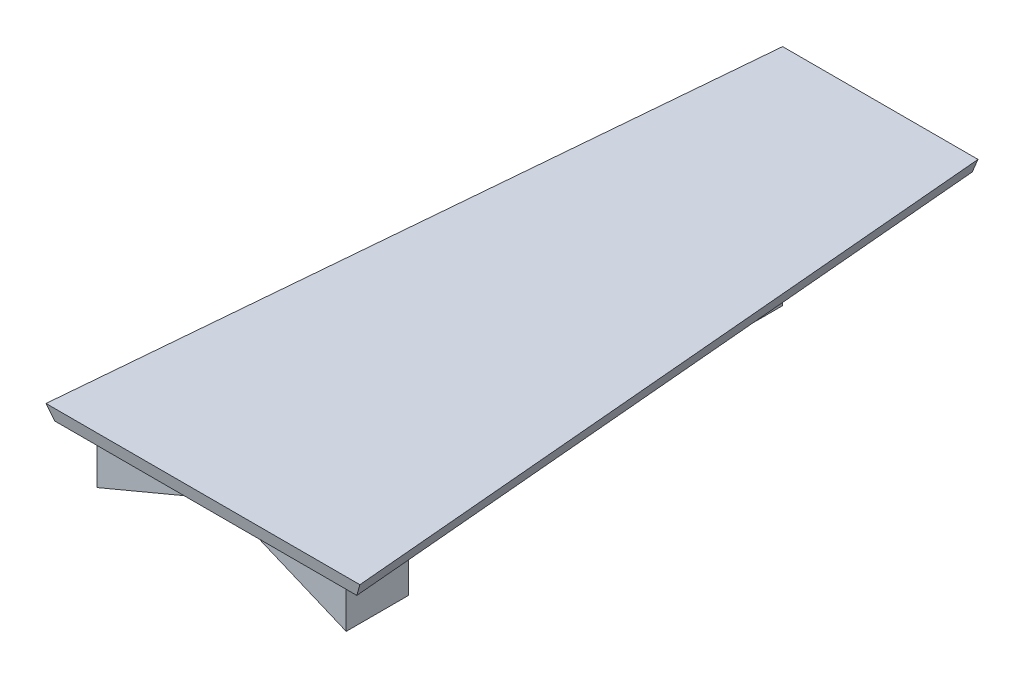
from build123d import *

# Parameters (mm, degrees)
SKIZZE1_W                            = 57
SKIZZE1_H                            = 123
AUFSATZ_LINEAR_AUSTRAGEN1_DEPTH      = 2.5
SCHNITT_LINEAR_AUSTRAGEN1_DEPTH      = 84.889808678
SCHNITT_LINEAR_AUSTRAGEN2_DEPTH      = 68.828828679
SCHNITT_LINEAR_AUSTRAGEN3_DEPTH      = 70.726045338
SCHNITT_LINEAR_AUSTRAGEN3_DEPTH_BACK = 70.726045338
SCHNITT_LINEAR_AUSTRAGEN4_DEPTH      = 70.47454308
SCHNITT_LINEAR_AUSTRAGEN4_DEPTH_BACK = 70.47454308
SKIZZE9_W                            = 45.241474544
SKIZZE9_H                            = 11.280630507
AUFSATZ_LINEAR_AUSTRAGEN2_DEPTH      = 13
SCHNITT_LINEAR_AUSTRAGEN5_DEPTH      = 20
SKIZZE12_W                           = 36.023643564
SKIZZE12_H                           = 10.472363364
AUFSATZ_LINEAR_AUSTRAGEN3_DEPTH      = 5
SCHNITT_LINEAR_AUSTRAGEN6_DEPTH      = 12
SCHNITT_LINEAR_AUSTRAGEN8_DEPTH      = 0.5
SCHNITT_LINEAR_AUSTRAGEN8_DEPTH_BACK = 1.6
SKIZZE16_R                           = 3.1
SCHNITT_LINEAR_AUSTRAGEN9_DEPTH      = 1.1
SCHNITT_LINEAR_AUSTRAGEN9_DEPTH_BACK = 1
SKIZZE17_R                           = 3.1


with BuildPart() as part:
    # Skizze1 → Aufsatz-Linear austragen1 (new body)
    with BuildSketch(Plane(origin=(0, 0, 0), x_dir=(1, 0, 0), z_dir=(0, 1, 0))):
        Rectangle(SKIZZE1_W, SKIZZE1_H)
    extrude(amount=AUFSATZ_LINEAR_AUSTRAGEN1_DEPTH)

    # Skizze2 → Schnitt-Linear austragen1 (cut, through all)
    with BuildSketch(Plane(origin=(28.5, 0, 0), x_dir=(0, 0, -1), z_dir=(1, 0, 0))):
        Polygon((-61.5, 2.5), (-61.5, 0), (-60.968608596, 0), align=None)
    extrude(amount=-SCHNITT_LINEAR_AUSTRAGEN1_DEPTH, mode=Mode.SUBTRACT)

    # Skizze3 → Schnitt-Linear austragen2 (cut, through all)
    with BuildSketch(Plane(origin=(0, 2.5, 0), x_dir=(1, 0, 0), z_dir=(0, 1, 0))):
        Polygon((-28.5, -61.5), (-17.738894386, 61.5), (-28.5, 61.5), align=None)
        Polygon((28.5, -61.5), (17.738894386, 61.5), (28.5, 61.5), align=None)
    extrude(amount=-SCHNITT_LINEAR_AUSTRAGEN2_DEPTH, mode=Mode.SUBTRACT)

    # Skizze5 → Schnitt-Linear austragen3 (cut, two sides: drawn at the far end of the back side and taken through both)
    with BuildSketch(Plane(origin=(0.175618176, 0, 2.007324937), x_dir=(0, -1, 0), z_dir=(0.08715574274765484, 0, 0.9961946980917459)).offset(-SCHNITT_LINEAR_AUSTRAGEN3_DEPTH_BACK)):
        Polygon((0.008562414, 23.031470717), (-2.5, 23.031470717), (0, 21.995936811), align=None)
    extrude(amount=SCHNITT_LINEAR_AUSTRAGEN3_DEPTH + SCHNITT_LINEAR_AUSTRAGEN3_DEPTH_BACK, mode=Mode.SUBTRACT)

    # Skizze6 → Schnitt-Linear austragen4 (cut, two sides: drawn at the far end of the back side and taken through both)
    with BuildSketch(Plane(origin=(-0.152372814, 0, 1.741629235), x_dir=(0, 1, 0), z_dir=(-0.08715574274766175, 0, 0.9961946980917452)).offset(-SCHNITT_LINEAR_AUSTRAGEN4_DEPTH_BACK)):
        Polygon((2.5, 23.031470717), (0, 21.995936811), (0, 23.031470717), align=None)
    extrude(amount=SCHNITT_LINEAR_AUSTRAGEN4_DEPTH + SCHNITT_LINEAR_AUSTRAGEN4_DEPTH_BACK, mode=Mode.SUBTRACT)

    # Skizze9 → Aufsatz-Linear austragen2 (add)
    with BuildSketch(Plane.XZ):
        with Locations((0, 52.468608596)):
            Rectangle(SKIZZE9_W, SKIZZE9_H)
    extrude(amount=AUFSATZ_LINEAR_AUSTRAGEN2_DEPTH)

    # Skizze11 → Schnitt-Linear austragen5 (cut)
    with BuildSketch(Plane(origin=(0, 0, 46.828293342), x_dir=(-1, 0, 0), z_dir=(0, 0, -1))):
        Polygon((-22.620737272, -9.484039906), (0, 0), (22.620737272, -9.484039906), (22.620737272, -13), (-22.620737272, -13), align=None)
    extrude(amount=-SCHNITT_LINEAR_AUSTRAGEN5_DEPTH, mode=Mode.SUBTRACT)

    # Skizze12 → Aufsatz-Linear austragen3 (add)
    with BuildSketch(Plane.XZ):
        with Locations((0, -20.5)):
            Rectangle(SKIZZE12_W, SKIZZE12_H)
    extrude(amount=AUFSATZ_LINEAR_AUSTRAGEN3_DEPTH)

    # Skizze13 → Schnitt-Linear austragen6 (cut)
    with BuildSketch(Plane(origin=(0, 0, -25.736181682), x_dir=(-1, 0, 0), z_dir=(0, 0, -1))):
        Polygon((-18.011821782, -2.5), (-7.183132097, 0), (7.183132097, 0), (18.011821782, -2.5), (18.011821782, -5), (-18.011821782, -5), align=None)
    extrude(amount=-SCHNITT_LINEAR_AUSTRAGEN6_DEPTH, mode=Mode.SUBTRACT)

    # Skizze16 → Schnitt-Linear austragen8 (cut, two sides: drawn at the far end of the back side and taken through both)
    with BuildSketch(Plane.XZ.offset(-SCHNITT_LINEAR_AUSTRAGEN8_DEPTH_BACK)):
        with Locations((12.59747694, -20.5)):
            Circle(SKIZZE16_R)
        with Locations((-12.59747694, -20.5)):
            Circle(SKIZZE16_R)
    extrude(amount=SCHNITT_LINEAR_AUSTRAGEN8_DEPTH + SCHNITT_LINEAR_AUSTRAGEN8_DEPTH_BACK, mode=Mode.SUBTRACT)

    # Skizze17 → Schnitt-Linear austragen9 (cut, two sides: drawn at the far end of the back side and taken through both)
    with BuildSketch(Plane(origin=(0, -4.742019953, 0), x_dir=(1, 0, 0), z_dir=(0, 1, 0)).offset(-SCHNITT_LINEAR_AUSTRAGEN9_DEPTH_BACK)):
        with Locations((-16.965552954, -52.468608596)):
            Circle(SKIZZE17_R)
        with Locations((16.965552954, -52.468608596)):
            Circle(SKIZZE17_R)
    extrude(amount=SCHNITT_LINEAR_AUSTRAGEN9_DEPTH + SCHNITT_LINEAR_AUSTRAGEN9_DEPTH_BACK, mode=Mode.SUBTRACT)


solid = part.part
